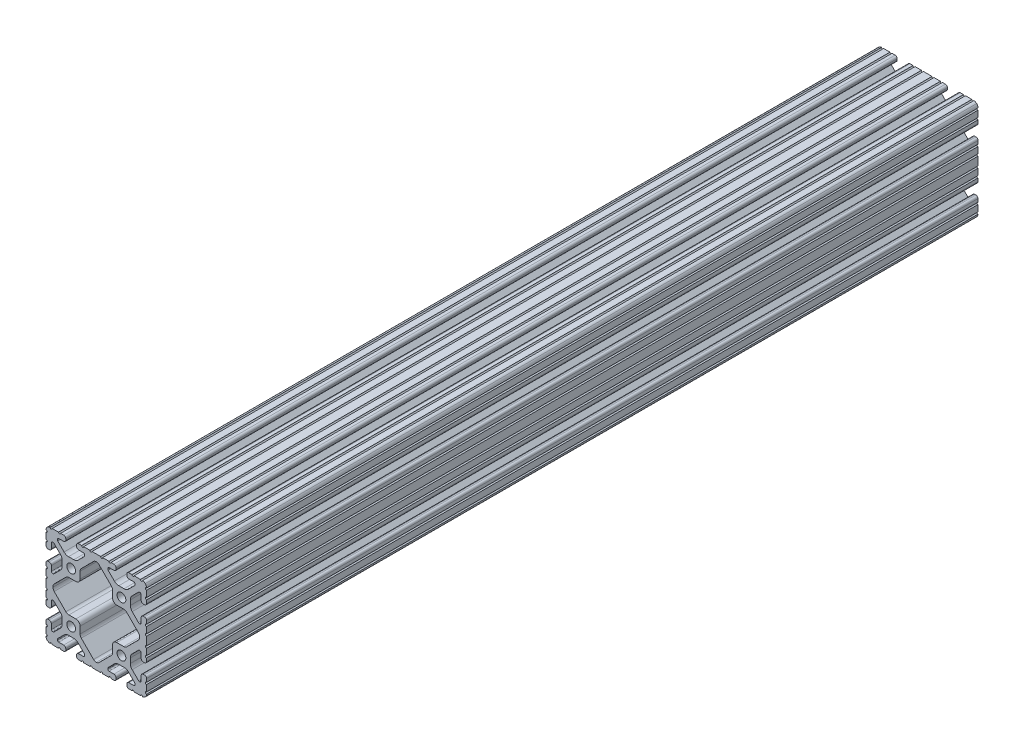
from build123d import *

# Parameters (mm, degrees)
BOSS_EXTRUDE1_DEPTH      = 315
BOSS_EXTRUDE1_DEPTH_BACK = 315
SKETCH3_R                = 3.3274


with BuildPart() as part:
    # Sketch3 → Boss-Extrude1 (new, two sides: drawn at the far end of the back side and taken through both)
    with BuildSketch(Plane.XY.offset(-BOSS_EXTRUDE1_DEPTH_BACK)):
        with BuildLine():
            Line((34.036, 28.448), (34.036, 24.630196049))
            ThreePointArc((34.036, 24.630196049), (34.497248241, 23.51664429), (35.6108, 23.055396049))
            Line((35.6108, 23.055396049), (36.525200183, 23.055396049))
            ThreePointArc((36.525200183, 23.055396049), (37.638751813, 23.516644236), (38.1, 24.630195866))
            Line((38.1, 24.630195866), (38.1, 27.023826138))
            ThreePointArc((38.1, 27.023826138), (37.117780706, 27.7845421), (38.1, 28.545258062))
            Line((38.1, 28.545258062), (38.1, 33.373016026))
            ThreePointArc((38.1, 33.373016026), (37.141472621, 34.109236774), (38.1, 34.845457521))
            ThreePointArc((38.1, 34.845457521), (37.837757813, 36.120195002), (37.086123144, 37.182631793))
            ThreePointArc((37.086123144, 37.182631793), (36.106286572, 37.843374398), (34.952681874, 38.1))
            ThreePointArc((34.952681874, 38.1), (34.190730434, 37.320215335), (33.428778994, 38.1))
            Line((33.428778994, 38.1), (28.601105935, 38.1))
            ThreePointArc((28.601105935, 38.1), (27.839158581, 37.32021942), (27.077211227, 38.1))
            Line((27.077211227, 38.1), (24.6888, 38.1))
            ThreePointArc((24.6888, 38.1), (23.575248241, 37.638751759), (23.114, 36.5252))
            Line((23.114, 36.5252), (23.114, 35.6108))
            ThreePointArc((23.114, 35.6108), (23.575248241, 34.497248241), (24.6888, 34.036))
            Line((24.6888, 34.036), (28.448, 34.036))
            ThreePointArc((28.448, 34.036), (29.076617928, 33.775617928), (29.337, 33.147))
            Line((29.337, 33.147), (29.337, 32.720693454))
            ThreePointArc((29.337, 32.720693454), (29.326675076, 32.273872751), (29.100231244, 31.888543625))
            Line((29.100231244, 31.888543625), (24.409287499, 27.197588341))
            ThreePointArc((24.409287499, 27.197588341), (22.868340045, 26.167958114), (21.050667579, 25.8064))
            Line((21.050667579, 25.8064), (17.049332421, 25.8064))
            ThreePointArc((17.049332421, 25.8064), (15.231659955, 26.167958114), (13.690712501, 27.197588341))
            Line((13.690712501, 27.197588341), (9.023381298, 31.864931024))
            ThreePointArc((9.023381298, 31.864931024), (8.830670886, 32.153343113), (8.763, 32.493548179))
            Line((8.763, 32.493548179), (8.763, 33.147))
            ThreePointArc((8.763, 33.147), (9.023382072, 33.775617928), (9.652, 34.036))
            Line((9.652, 34.036), (13.4112, 34.036))
            ThreePointArc((13.4112, 34.036), (14.524751759, 34.497248241), (14.986, 35.6108))
            Line((14.986, 35.6108), (14.986, 36.5252))
            ThreePointArc((14.986, 36.5252), (14.524751759, 37.638751759), (13.4112, 38.1))
            Line((13.4112, 38.1), (11.128867074, 38.1))
            ThreePointArc((11.128867074, 38.1), (10.367071033, 37.320370693), (9.605274992, 38.1))
            Line((9.605274992, 38.1), (4.777313069, 38.1))
            ThreePointArc((4.777313069, 38.1), (4.015517029, 37.320370693), (3.253720988, 38.1))
            Line((3.253720988, 38.1), (-3.253720988, 38.1))
            ThreePointArc((-3.253720988, 38.1), (-4.015517029, 37.320370693), (-4.777313069, 38.1))
            Line((-4.777313069, 38.1), (-9.605274992, 38.1))
            ThreePointArc((-9.605274992, 38.1), (-10.367071033, 37.320370693), (-11.128867074, 38.1))
            Line((-11.128867074, 38.1), (-13.4112, 38.1))
            ThreePointArc((-13.4112, 38.1), (-14.524751759, 37.638751759), (-14.986, 36.5252))
            Line((-14.986, 36.5252), (-14.986, 35.6108))
            ThreePointArc((-14.986, 35.6108), (-14.524751759, 34.497248241), (-13.4112, 34.036))
            Line((-13.4112, 34.036), (-9.652, 34.036))
            ThreePointArc((-9.652, 34.036), (-9.023382072, 33.775617928), (-8.763, 33.147))
            Line((-8.763, 33.147), (-8.763, 32.493548179))
            ThreePointArc((-8.763, 32.493548179), (-8.830670886, 32.153343113), (-9.023381298, 31.864931024))
            Line((-9.023381298, 31.864931024), (-13.690712501, 27.197588341))
            ThreePointArc((-13.690712501, 27.197588341), (-15.231659955, 26.167958114), (-17.049332421, 25.8064))
            Line((-17.049332421, 25.8064), (-21.050667579, 25.8064))
            ThreePointArc((-21.050667579, 25.8064), (-22.868340045, 26.167958114), (-24.409287499, 27.197588341))
            Line((-24.409287499, 27.197588341), (-29.100231244, 31.888543625))
            ThreePointArc((-29.100231244, 31.888543625), (-29.326675076, 32.273872751), (-29.337, 32.720693454))
            Line((-29.337, 32.720693454), (-29.337, 33.147))
            ThreePointArc((-29.337, 33.147), (-29.076617928, 33.775617928), (-28.448, 34.036))
            Line((-28.448, 34.036), (-24.6888, 34.036))
            ThreePointArc((-24.6888, 34.036), (-23.575248241, 34.497248241), (-23.114, 35.6108))
            Line((-23.114, 35.6108), (-23.114, 36.5252))
            ThreePointArc((-23.114, 36.5252), (-23.575248241, 37.638751759), (-24.6888, 38.1))
            Line((-24.6888, 38.1), (-27.077211227, 38.1))
            ThreePointArc((-27.077211227, 38.1), (-27.839158581, 37.32021942), (-28.601105935, 38.1))
            Line((-28.601105935, 38.1), (-33.428778994, 38.1))
            ThreePointArc((-33.428778994, 38.1), (-34.190730434, 37.320215335), (-34.952681874, 38.1))
            ThreePointArc((-34.952681874, 38.1), (-36.106286572, 37.843374398), (-37.086123144, 37.182631793))
            ThreePointArc((-37.086123144, 37.182631793), (-37.837757813, 36.120195002), (-38.1, 34.845457521))
            ThreePointArc((-38.1, 34.845457521), (-37.141472621, 34.109236774), (-38.1, 33.373016026))
            Line((-38.1, 33.373016026), (-38.1, 28.545258062))
            ThreePointArc((-38.1, 28.545258062), (-37.117780706, 27.7845421), (-38.1, 27.023826138))
            Line((-38.1, 27.023826138), (-38.1, 24.630195866))
            ThreePointArc((-38.1, 24.630195866), (-37.638751813, 23.516644236), (-36.525200183, 23.055396049))
            Line((-36.525200183, 23.055396049), (-35.6108, 23.055396049))
            ThreePointArc((-35.6108, 23.055396049), (-34.497248241, 23.51664429), (-34.036, 24.630196049))
            Line((-34.036, 24.630196049), (-34.036, 28.448))
            ThreePointArc((-34.036, 28.448), (-33.775617928, 29.076617928), (-33.147, 29.337))
            Line((-33.147, 29.337), (-32.664287242, 29.337))
            ThreePointArc((-32.664287242, 29.337), (-32.324081166, 29.269328695), (-32.03566854, 29.076617155))
            Line((-32.03566854, 29.076617155), (-27.19758008, 24.238516795))
            ThreePointArc((-27.19758008, 24.238516795), (-26.167955879, 22.697572205), (-25.8064, 20.879905136))
            Line((-25.8064, 20.879905136), (-25.8064, 17.220094864))
            ThreePointArc((-25.8064, 17.220094864), (-26.167955879, 15.402427795), (-27.19758008, 13.861483205))
            Line((-27.19758008, 13.861483205), (-31.948944541, 9.110107057))
            ThreePointArc((-31.948944541, 9.110107057), (-32.333417096, 8.853210196), (-32.786933649, 8.763))
            Line((-32.786933649, 8.763), (-33.060275787, 8.763))
            ThreePointArc((-33.060275787, 8.763), (-33.750216995, 9.048783005), (-34.036, 9.738724213))
            Line((-34.036, 9.738724213), (-34.036, 13.469803585))
            ThreePointArc((-34.036, 13.469803585), (-34.497248348, 14.583355603), (-35.610800366, 15.044603951))
            Line((-35.610800366, 15.044603951), (-36.5252, 15.044603951))
            ThreePointArc((-36.5252, 15.044603951), (-37.638751759, 14.58335571), (-38.1, 13.469803951))
            Line((-38.1, 13.469803951), (-38.1, 11.075039289))
            ThreePointArc((-38.1, 11.075039289), (-37.117000248, 10.313517272), (-38.1, 9.551995255))
            Line((-38.1, 9.551995255), (-38.1, 4.723759308))
            ThreePointArc((-38.1, 4.723759308), (-37.117000248, 3.962237292), (-38.1, 3.200715275))
            Line((-38.1, 3.200715275), (-38.1, -3.200715275))
            ThreePointArc((-38.1, -3.200715275), (-37.117000248, -3.962237292), (-38.1, -4.723759308))
            Line((-38.1, -4.723759308), (-38.1, -9.551995255))
            ThreePointArc((-38.1, -9.551995255), (-37.117000248, -10.313517272), (-38.1, -11.075039289))
            Line((-38.1, -11.075039289), (-38.1, -13.469803951))
            ThreePointArc((-38.1, -13.469803951), (-37.638751759, -14.58335571), (-36.5252, -15.044603951))
            Line((-36.5252, -15.044603951), (-35.610800366, -15.044603951))
            ThreePointArc((-35.610800366, -15.044603951), (-34.497248348, -14.583355603), (-34.036, -13.469803585))
            Line((-34.036, -13.469803585), (-34.036, -9.738724213))
            ThreePointArc((-34.036, -9.738724213), (-33.750216995, -9.048783005), (-33.060275787, -8.763))
            Line((-33.060275787, -8.763), (-32.786933649, -8.763))
            ThreePointArc((-32.786933649, -8.763), (-32.333417096, -8.853210196), (-31.948944541, -9.110107057))
            Line((-31.948944541, -9.110107057), (-27.19758008, -13.861483205))
            ThreePointArc((-27.19758008, -13.861483205), (-26.167955879, -15.402427795), (-25.8064, -17.220094864))
            Line((-25.8064, -17.220094864), (-25.8064, -20.879905136))
            ThreePointArc((-25.8064, -20.879905136), (-26.167955879, -22.697572205), (-27.19758008, -24.238516795))
            Line((-27.19758008, -24.238516795), (-32.03566854, -29.076617155))
            ThreePointArc((-32.03566854, -29.076617155), (-32.324081166, -29.269328695), (-32.664287242, -29.337))
            Line((-32.664287242, -29.337), (-33.147, -29.337))
            ThreePointArc((-33.147, -29.337), (-33.775617928, -29.076617928), (-34.036, -28.448))
            Line((-34.036, -28.448), (-34.036, -24.630196049))
            ThreePointArc((-34.036, -24.630196049), (-34.497248241, -23.51664429), (-35.6108, -23.055396049))
            Line((-35.6108, -23.055396049), (-36.525200183, -23.055396049))
            ThreePointArc((-36.525200183, -23.055396049), (-37.638751813, -23.516644236), (-38.1, -24.630195866))
            Line((-38.1, -24.630195866), (-38.1, -27.023826138))
            ThreePointArc((-38.1, -27.023826138), (-37.117780706, -27.7845421), (-38.1, -28.545258062))
            Line((-38.1, -28.545258062), (-38.1, -33.373016026))
            ThreePointArc((-38.1, -33.373016026), (-37.141472621, -34.109236774), (-38.1, -34.845457521))
            ThreePointArc((-38.1, -34.845457521), (-37.837757813, -36.120195002), (-37.086123144, -37.182631793))
            ThreePointArc((-37.086123144, -37.182631793), (-36.106286572, -37.843374398), (-34.952681874, -38.1))
            ThreePointArc((-34.952681874, -38.1), (-34.190730434, -37.320215335), (-33.428778994, -38.1))
            Line((-33.428778994, -38.1), (-28.601105935, -38.1))
            ThreePointArc((-28.601105935, -38.1), (-27.839158581, -37.32021942), (-27.077211227, -38.1))
            Line((-27.077211227, -38.1), (-24.6888, -38.1))
            ThreePointArc((-24.6888, -38.1), (-23.575248241, -37.638751759), (-23.114, -36.5252))
            Line((-23.114, -36.5252), (-23.114, -35.6108))
            ThreePointArc((-23.114, -35.6108), (-23.575248241, -34.497248241), (-24.6888, -34.036))
            Line((-24.6888, -34.036), (-28.448, -34.036))
            ThreePointArc((-28.448, -34.036), (-29.076617928, -33.775617928), (-29.337, -33.147))
            Line((-29.337, -33.147), (-29.337, -32.720693454))
            ThreePointArc((-29.337, -32.720693454), (-29.326675076, -32.273872751), (-29.100231244, -31.888543625))
            Line((-29.100231244, -31.888543625), (-24.409287499, -27.197588341))
            ThreePointArc((-24.409287499, -27.197588341), (-22.868340045, -26.167958114), (-21.050667579, -25.8064))
            Line((-21.050667579, -25.8064), (-17.049332421, -25.8064))
            ThreePointArc((-17.049332421, -25.8064), (-15.231659955, -26.167958114), (-13.690712501, -27.197588341))
            Line((-13.690712501, -27.197588341), (-9.023381298, -31.864931024))
            ThreePointArc((-9.023381298, -31.864931024), (-8.830670886, -32.153343113), (-8.763, -32.493548179))
            Line((-8.763, -32.493548179), (-8.763, -33.147))
            ThreePointArc((-8.763, -33.147), (-9.023382072, -33.775617928), (-9.652, -34.036))
            Line((-9.652, -34.036), (-13.4112, -34.036))
            ThreePointArc((-13.4112, -34.036), (-14.524751759, -34.497248241), (-14.986, -35.6108))
            Line((-14.986, -35.6108), (-14.986, -36.5252))
            ThreePointArc((-14.986, -36.5252), (-14.524751759, -37.638751759), (-13.4112, -38.1))
            Line((-13.4112, -38.1), (-11.128867074, -38.1))
            ThreePointArc((-11.128867074, -38.1), (-10.367071033, -37.320370693), (-9.605274992, -38.1))
            Line((-9.605274992, -38.1), (-4.777313069, -38.1))
            ThreePointArc((-4.777313069, -38.1), (-4.015517029, -37.320370693), (-3.253720988, -38.1))
            Line((-3.253720988, -38.1), (3.253720988, -38.1))
            ThreePointArc((3.253720988, -38.1), (4.015517029, -37.320370693), (4.777313069, -38.1))
            Line((4.777313069, -38.1), (9.605274992, -38.1))
            ThreePointArc((9.605274992, -38.1), (10.367071033, -37.320370693), (11.128867074, -38.1))
            Line((11.128867074, -38.1), (13.4112, -38.1))
            ThreePointArc((13.4112, -38.1), (14.524751759, -37.638751759), (14.986, -36.5252))
            Line((14.986, -36.5252), (14.986, -35.6108))
            ThreePointArc((14.986, -35.6108), (14.524751759, -34.497248241), (13.4112, -34.036))
            Line((13.4112, -34.036), (9.652, -34.036))
            ThreePointArc((9.652, -34.036), (9.023382072, -33.775617928), (8.763, -33.147))
            Line((8.763, -33.147), (8.763, -32.493548179))
            ThreePointArc((8.763, -32.493548179), (8.830670886, -32.153343113), (9.023381298, -31.864931024))
            Line((9.023381298, -31.864931024), (13.690712501, -27.197588341))
            ThreePointArc((13.690712501, -27.197588341), (15.231659955, -26.167958114), (17.049332421, -25.8064))
            Line((17.049332421, -25.8064), (21.050667579, -25.8064))
            ThreePointArc((21.050667579, -25.8064), (22.868340045, -26.167958114), (24.409287499, -27.197588341))
            Line((24.409287499, -27.197588341), (29.100231244, -31.888543625))
            ThreePointArc((29.100231244, -31.888543625), (29.326675076, -32.273872751), (29.337, -32.720693454))
            Line((29.337, -32.720693454), (29.337, -33.147))
            ThreePointArc((29.337, -33.147), (29.076617928, -33.775617928), (28.448, -34.036))
            Line((28.448, -34.036), (24.6888, -34.036))
            ThreePointArc((24.6888, -34.036), (23.575248241, -34.497248241), (23.114, -35.6108))
            Line((23.114, -35.6108), (23.114, -36.5252))
            ThreePointArc((23.114, -36.5252), (23.575248241, -37.638751759), (24.6888, -38.1))
            Line((24.6888, -38.1), (27.077211227, -38.1))
            ThreePointArc((27.077211227, -38.1), (27.839158581, -37.32021942), (28.601105935, -38.1))
            Line((28.601105935, -38.1), (33.428778994, -38.1))
            ThreePointArc((33.428778994, -38.1), (34.190730434, -37.320215335), (34.952681874, -38.1))
            ThreePointArc((34.952681874, -38.1), (36.106286572, -37.843374398), (37.086123144, -37.182631793))
            ThreePointArc((37.086123144, -37.182631793), (37.837757813, -36.120195002), (38.1, -34.845457521))
            ThreePointArc((38.1, -34.845457521), (37.141472621, -34.109236774), (38.1, -33.373016026))
            Line((38.1, -33.373016026), (38.1, -28.545258062))
            ThreePointArc((38.1, -28.545258062), (37.117780706, -27.7845421), (38.1, -27.023826138))
            Line((38.1, -27.023826138), (38.1, -24.630195866))
            ThreePointArc((38.1, -24.630195866), (37.638751813, -23.516644236), (36.525200183, -23.055396049))
            Line((36.525200183, -23.055396049), (35.6108, -23.055396049))
            ThreePointArc((35.6108, -23.055396049), (34.497248241, -23.51664429), (34.036, -24.630196049))
            Line((34.036, -24.630196049), (34.036, -28.448))
            ThreePointArc((34.036, -28.448), (33.775617928, -29.076617928), (33.147, -29.337))
            Line((33.147, -29.337), (32.664287242, -29.337))
            ThreePointArc((32.664287242, -29.337), (32.324081166, -29.269328695), (32.03566854, -29.076617155))
            Line((32.03566854, -29.076617155), (27.19758008, -24.238516795))
            ThreePointArc((27.19758008, -24.238516795), (26.167955879, -22.697572205), (25.8064, -20.879905136))
            Line((25.8064, -20.879905136), (25.8064, -17.220094864))
            ThreePointArc((25.8064, -17.220094864), (26.167955879, -15.402427795), (27.19758008, -13.861483205))
            Line((27.19758008, -13.861483205), (31.948944541, -9.110107057))
            ThreePointArc((31.948944541, -9.110107057), (32.333417096, -8.853210196), (32.786933649, -8.763))
            Line((32.786933649, -8.763), (33.060275787, -8.763))
            ThreePointArc((33.060275787, -8.763), (33.750216995, -9.048783005), (34.036, -9.738724213))
            Line((34.036, -9.738724213), (34.036, -13.469803585))
            ThreePointArc((34.036, -13.469803585), (34.497248348, -14.583355603), (35.610800366, -15.044603951))
            Line((35.610800366, -15.044603951), (36.5252, -15.044603951))
            ThreePointArc((36.5252, -15.044603951), (37.638751759, -14.58335571), (38.1, -13.469803951))
            Line((38.1, -13.469803951), (38.1, -11.075039289))
            ThreePointArc((38.1, -11.075039289), (37.117000248, -10.313517272), (38.1, -9.551995255))
            Line((38.1, -9.551995255), (38.1, -4.723759308))
            ThreePointArc((38.1, -4.723759308), (37.117000248, -3.962237292), (38.1, -3.200715275))
            Line((38.1, -3.200715275), (38.1, 3.200715275))
            ThreePointArc((38.1, 3.200715275), (37.117000248, 3.962237292), (38.1, 4.723759308))
            Line((38.1, 4.723759308), (38.1, 9.551995255))
            ThreePointArc((38.1, 9.551995255), (37.117000248, 10.313517272), (38.1, 11.075039289))
            Line((38.1, 11.075039289), (38.1, 13.469803951))
            ThreePointArc((38.1, 13.469803951), (37.638751759, 14.58335571), (36.5252, 15.044603951))
            Line((36.5252, 15.044603951), (35.610800366, 15.044603951))
            ThreePointArc((35.610800366, 15.044603951), (34.497248348, 14.583355603), (34.036, 13.469803585))
            Line((34.036, 13.469803585), (34.036, 9.738724213))
            ThreePointArc((34.036, 9.738724213), (33.750216995, 9.048783005), (33.060275787, 8.763))
            Line((33.060275787, 8.763), (32.786933649, 8.763))
            ThreePointArc((32.786933649, 8.763), (32.333417096, 8.853210196), (31.948944541, 9.110107057))
            Line((31.948944541, 9.110107057), (27.19758008, 13.861483205))
            ThreePointArc((27.19758008, 13.861483205), (26.167955879, 15.402427795), (25.8064, 17.220094864))
            Line((25.8064, 17.220094864), (25.8064, 20.879905136))
            ThreePointArc((25.8064, 20.879905136), (26.167955879, 22.697572205), (27.19758008, 24.238516795))
            Line((27.19758008, 24.238516795), (32.03566854, 29.076617155))
            ThreePointArc((32.03566854, 29.076617155), (32.324081166, 29.269328695), (32.664287242, 29.337))
            Line((32.664287242, 29.337), (33.147, 29.337))
            ThreePointArc((33.147, 29.337), (33.775617928, 29.076617928), (34.036, 28.448))
        make_face()
        with Locations((19.05, 19.05)):
            Circle(SKETCH3_R, mode=Mode.SUBTRACT)
        with Locations((-19.05, 19.05)):
            Circle(SKETCH3_R, mode=Mode.SUBTRACT)
        with Locations((19.05, -19.05)):
            Circle(SKETCH3_R, mode=Mode.SUBTRACT)
        with Locations((-19.05, -19.05)):
            Circle(SKETCH3_R, mode=Mode.SUBTRACT)
        with BuildLine():
            Line((-11.363666791, -22.843321003), (-2.051515952, -32.155494748))
            ThreePointArc((-2.051515952, -32.155494748), (-1.11031328, -32.786013752), (0, -33.011005091))
            ThreePointArc((0, -33.011005091), (1.11031328, -32.786013752), (2.051515952, -32.155494748))
            Line((2.051515952, -32.155494748), (11.363666791, -22.843321003))
            ThreePointArc((11.363666791, -22.843321003), (12.051918263, -21.813277828), (12.2936, -20.598259734))
            Line((12.2936, -20.598259734), (12.2936, -15.4686))
            ThreePointArc((12.2936, -15.4686), (13.22353597, -13.22353597), (15.4686, -12.2936))
            Line((15.4686, -12.2936), (20.769026744, -12.2936))
            ThreePointArc((20.769026744, -12.2936), (21.984048446, -12.051916769), (23.014093535, -11.363661269))
            Line((23.014093535, -11.363661269), (31.902125566, -2.475607377))
            ThreePointArc((31.902125566, -2.475607377), (32.607298578, -1.335259481), (32.728725173, 0))
            ThreePointArc((32.728725173, 0), (32.607298578, 1.335259481), (31.902125566, 2.475607377))
            Line((31.902125566, 2.475607377), (23.014093535, 11.363661269))
            ThreePointArc((23.014093535, 11.363661269), (21.984048446, 12.051916769), (20.769026744, 12.2936))
            Line((20.769026744, 12.2936), (15.4686, 12.2936))
            ThreePointArc((15.4686, 12.2936), (13.22353597, 13.22353597), (12.2936, 15.4686))
            Line((12.2936, 15.4686), (12.2936, 20.598259734))
            ThreePointArc((12.2936, 20.598259734), (12.051918263, 21.813277828), (11.363666791, 22.843321003))
            Line((11.363666791, 22.843321003), (2.051515952, 32.155494748))
            ThreePointArc((2.051515952, 32.155494748), (1.11031328, 32.786013752), (0, 33.011005091))
            ThreePointArc((0, 33.011005091), (-1.11031328, 32.786013752), (-2.051515952, 32.155494748))
            Line((-2.051515952, 32.155494748), (-11.363666791, 22.843321003))
            ThreePointArc((-11.363666791, 22.843321003), (-12.051918263, 21.813277828), (-12.2936, 20.598259734))
            Line((-12.2936, 20.598259734), (-12.2936, 15.4686))
            ThreePointArc((-12.2936, 15.4686), (-13.22353597, 13.22353597), (-15.4686, 12.2936))
            Line((-15.4686, 12.2936), (-20.769026744, 12.2936))
            ThreePointArc((-20.769026744, 12.2936), (-21.984048446, 12.051916769), (-23.014093535, 11.363661269))
            Line((-23.014093535, 11.363661269), (-31.902125566, 2.475607377))
            ThreePointArc((-31.902125566, 2.475607377), (-32.607298578, 1.335259481), (-32.728725173, 0))
            ThreePointArc((-32.728725173, 0), (-32.607298578, -1.335259481), (-31.902125566, -2.475607377))
            Line((-31.902125566, -2.475607377), (-23.014093535, -11.363661269))
            ThreePointArc((-23.014093535, -11.363661269), (-21.984048446, -12.051916769), (-20.769026744, -12.2936))
            Line((-20.769026744, -12.2936), (-15.4686, -12.2936))
            ThreePointArc((-15.4686, -12.2936), (-13.22353597, -13.22353597), (-12.2936, -15.4686))
            Line((-12.2936, -15.4686), (-12.2936, -20.598259734))
            ThreePointArc((-12.2936, -20.598259734), (-12.051918263, -21.813277828), (-11.363666791, -22.843321003))
        make_face(mode=Mode.SUBTRACT)
    extrude(amount=BOSS_EXTRUDE1_DEPTH + BOSS_EXTRUDE1_DEPTH_BACK)


solid = part.part
